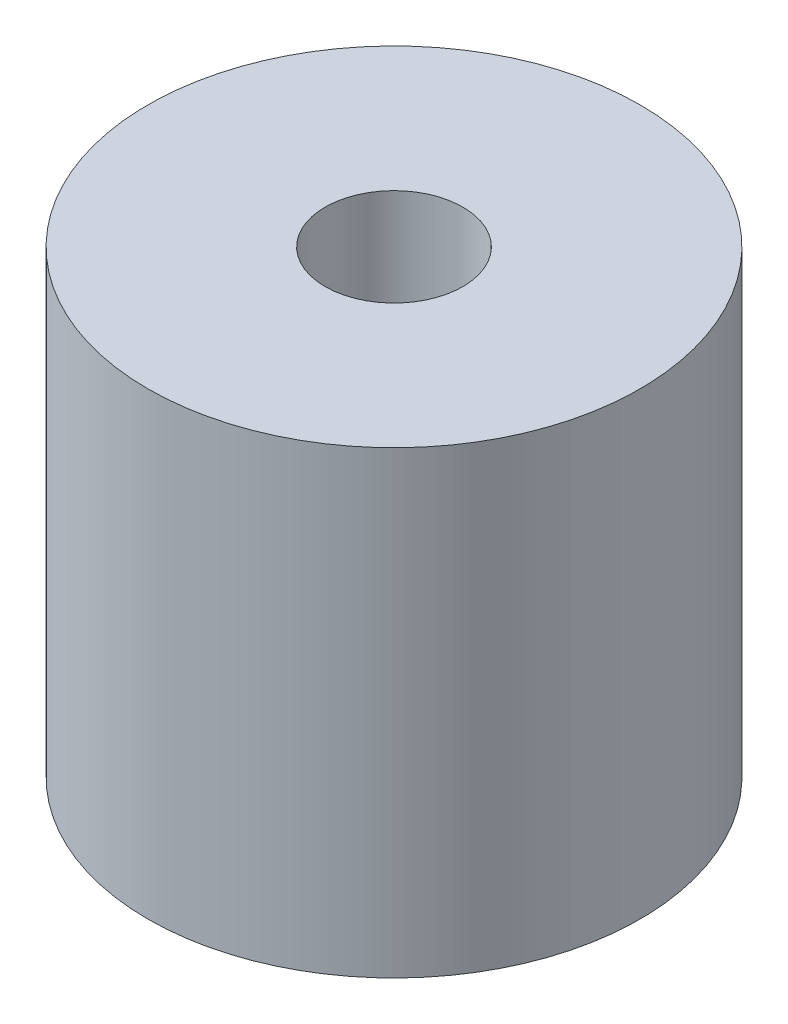
from build123d import *

# Parameters (mm, degrees)
SKETCH1_R           = 7.5
SKETCH1_R_2         = 2.1
BOSS_EXTRUDE1_DEPTH = 14


with BuildPart() as part:
    # Sketch1 → Boss-Extrude1 (new body)
    with BuildSketch(Plane(origin=(0, 0, 0), x_dir=(1, 0, 0), z_dir=(0, 1, 0))):
        with Locations(Location((0, 0, 0), (0, 0, 270))):
            Circle(SKETCH1_R)
        with Locations(Location((0, 0, 0), (0, 0, 270))):
            Circle(SKETCH1_R_2, mode=Mode.SUBTRACT)
    extrude(amount=BOSS_EXTRUDE1_DEPTH)


solid = part.part
